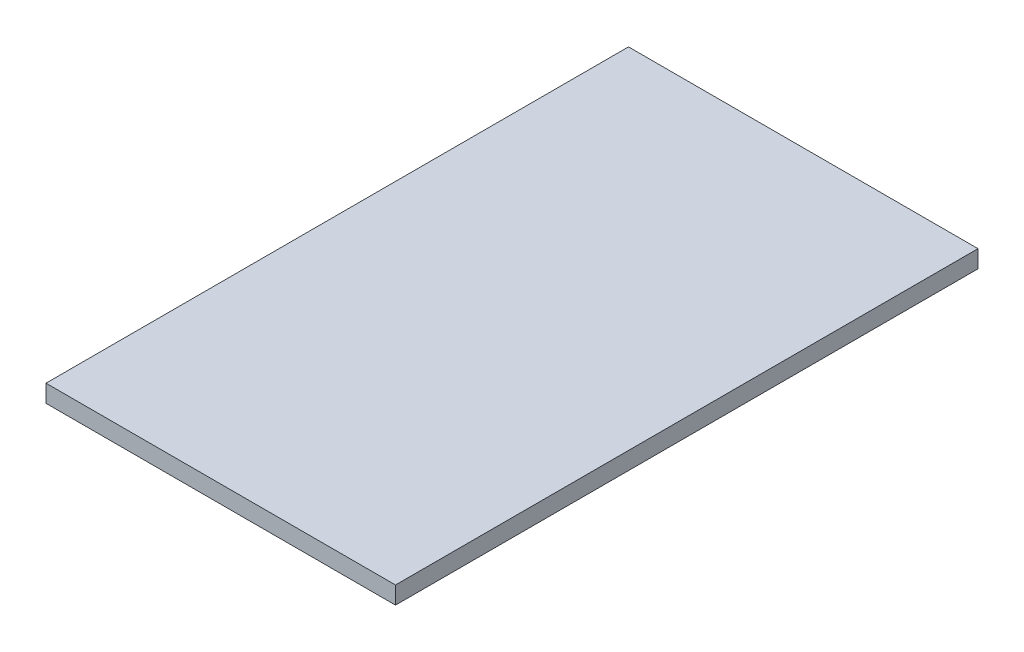
from build123d import *

# Parameters (mm, degrees)
SKETCH1_W           = 600
SKETCH1_H           = 1000
BOSS_EXTRUDE1_DEPTH = 30


with BuildPart() as part:
    # Sketch1 → Boss-Extrude1 (new body)
    with BuildSketch(Plane(origin=(0, 0, 0), x_dir=(1, 0, 0), z_dir=(0, 1, 0))):
        Rectangle(SKETCH1_W, SKETCH1_H)
    extrude(amount=BOSS_EXTRUDE1_DEPTH)


solid = part.part
